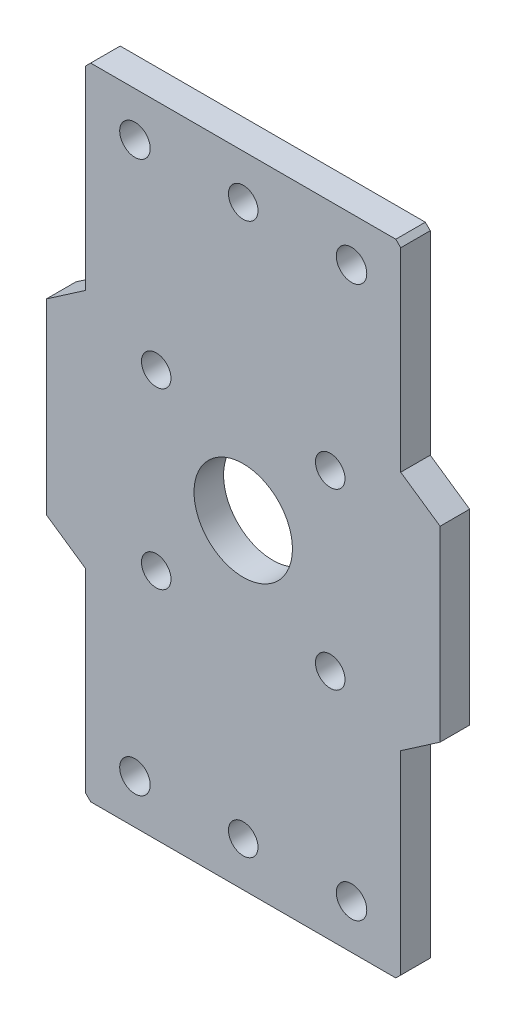
from build123d import *

# Parameters (mm, degrees)
IZIM1_R                      = 1
Y_KSEKLIK_EKSTR_ZYON1_DEPTH  = 3
KES_EKSTR_ZYON1_DEPTH        = 10
Y_KSEKLIK_EKSTR_ZYON2_DEPTH  = 3
IZIM6_R                      = 1.55
Y_KSEKLIK_EKSTR_ZYON4_DEPTH  = 3
IZIM9_W                      = 2.764853826
IZIM9_H                      = 2.899724745
IZIM9_W_2                    = 2.53555673
IZIM9_H_2                    = 2.630505748
Y_KSEKLIK_EKSTR_ZYON5_DEPTH  = 3
IZIM8_R                      = 1.55
Y_KSEKLIK_EKSTR_ZYON6_DEPTH  = 3
IZIM10_R                     = 1.55
KES_EKSTR_ZYON2_DEPTH        = 10
IZIM14_R                     = 1.5
KES_EKSTR_ZYON3_DEPTH        = 10
IZIM15_R                     = 5
KES_EKSTR_ZYON4_DEPTH        = 10
Y_KSEKLIK_EKSTR_ZYON7_DEPTH  = 3
KES_EKSTR_ZYON5_DEPTH        = 3
IZIM23_R                     = 1.55
KES_EKSTR_ZYON6_DEPTH        = 3
IZIM25_R                     = 1.5
KES_EKSTR_ZYON7_DEPTH        = 3
Y_KSEKLIK_EKSTR_ZYON8_DEPTH  = 3
IZIM27_W                     = 26
IZIM27_H                     = 10
Y_KSEKLIK_EKSTR_ZYON9_DEPTH  = 3
IZIM28_W                     = 32
IZIM28_H                     = 10.183470431
KES_EKSTR_ZYON8_DEPTH        = 10
IZIM29_W                     = 21.597894427
IZIM29_H                     = 9.610197834
Y_KSEKLIK_EKSTR_ZYON11_DEPTH = 3
IZIM30_W                     = 32
IZIM30_H                     = 0.75
IZIM30_H_2                   = 0.5
KES_EKSTR_ZYON9_DEPTH        = 10
PAH1_SIZE                    = 0.5


with BuildPart() as part:
    # Çizim1 → Yükseklik-Ekstrüzyon1 (new body)
    # profile 1 of 2: a face of its own
    with BuildSketch(Plane.XY):
        Polygon((7.5, 49.5), (0, 49.5), (0, 46.25495549), (3, 46.25495549), (3.494974747, 46.749930237), (5.494974747, 46.749930237), (8.5, 44.749930237), (8.5, 43.249930237), (8.5, 41.749930237), (5.494974747, 39.749930237), (3.494974747, 39.749930237), (3, 40.244904984), (0, 40.244904984), (0, -51.5), (8.5, -51.5), (13.25, -48.202566926), (13.25, -43.75), (12.5, -43), (12.5, -35), (13.25, -34.25), (13.25, -28.25), (12.5, -27.5), (12.5, -19.5), (13.25, -18.75), (13.25, -12.75), (12.5, -12), (12.5, -4), (14, -2.5), (14, -2), (16, 0), (16, 13), (20, 15.75), (20, 33.5), (20, 34.75), (16, 37.5), (16, 47.5), (12, 51.5), (9.5, 51.5), align=None)
        Polygon((2.624434095, -42.600069763), (3.119408841, -42.105095016), (3.119408841, -36.105095016), (2.624434095, -35.610120269), (2.624434095, -33.610120269), (4.624434095, -30.605095016), (6.124434095, -30.605095016), (7.624434095, -30.605095016), (9.624434095, -33.610120269), (9.624434095, -35.610120269), (9.129459348, -36.105095016), (9.129459348, -42.105095016), (9.624434095, -42.600069763), (9.624434095, -44.600069763), (7.624434095, -47.605095016), (6.124434095, -47.605095016), (4.624434095, -47.605095016), (2.624434095, -44.600069763), align=None, mode=Mode.SUBTRACT)
        Polygon((4.624434095, -7.305095016), (6.124434095, -7.305095016), (7.624434095, -7.305095016), (9.624434095, -10.310120269), (9.624434095, -12.310120269), (9.129459348, -12.805095016), (9.129459348, -18.805095016), (9.624434095, -19.300069763), (9.624434095, -21.300069763), (7.624434095, -24.305095016), (6.124434095, -24.305095016), (4.624434095, -24.305095016), (2.624434095, -21.300069763), (2.624434095, -19.300069763), (3.119408841, -18.805095016), (3.119408841, -12.805095016), (2.624434095, -12.310120269), (2.624434095, -10.310120269), align=None, mode=Mode.SUBTRACT)
        with Locations((11, -0.75)):
            Circle(IZIM1_R, mode=Mode.SUBTRACT)
        with Locations((11, 48.25)):
            Circle(IZIM1_R, mode=Mode.SUBTRACT)
    # profile 2 of 2: a face of its own
    with BuildSketch(Plane.XY):
        Polygon((-9.5, 51.5), (-12, 51.5), (-16, 47.5), (-16, 37.5), (-20, 34.75), (-20, 33.5), (-20, 15.75), (-16, 13), (-16, 0), (-14, -2), (-14, -2.5), (-12.5, -4), (-12.5, -12), (-13.25, -12.75), (-13.25, -18.75), (-12.5, -19.5), (-12.5, -27.5), (-13.25, -28.25), (-13.25, -34.25), (-12.5, -35), (-12.5, -43), (-13.25, -43.75), (-13.25, -48.202566926), (-8.5, -51.5), (0, -51.5), (0, 40.244904984), (-3, 40.244904984), (-3.494974747, 39.749930237), (-5.494974747, 39.749930237), (-8.5, 41.749930237), (-8.5, 43.249930237), (-8.5, 44.749930237), (-5.494974747, 46.749930237), (-3.494974747, 46.749930237), (-3, 46.25495549), (0, 46.25495549), (0, 49.5), (-7.5, 49.5), align=None)
        Polygon((-2.624434095, -35.610120269), (-3.119408841, -36.105095016), (-3.119408841, -42.105095016), (-2.624434095, -42.600069763), (-2.624434095, -44.600069763), (-4.624434095, -47.605095016), (-6.124434095, -47.605095016), (-7.624434095, -47.605095016), (-9.624434095, -44.600069763), (-9.624434095, -42.600069763), (-9.129459348, -42.105095016), (-9.129459348, -36.105095016), (-9.624434095, -35.610120269), (-9.624434095, -33.610120269), (-7.624434095, -30.605095016), (-6.124434095, -30.605095016), (-4.624434095, -30.605095016), (-2.624434095, -33.610120269), align=None, mode=Mode.SUBTRACT)
        with Locations((-11, -0.75)):
            Circle(IZIM1_R, mode=Mode.SUBTRACT)
        Polygon((-3.119408841, -18.805095016), (-2.624434095, -19.300069763), (-2.624434095, -21.300069763), (-4.624434095, -24.305095016), (-6.124434095, -24.305095016), (-7.624434095, -24.305095016), (-9.624434095, -21.300069763), (-9.624434095, -19.300069763), (-9.129459348, -18.805095016), (-9.129459348, -12.805095016), (-9.624434095, -12.310120269), (-9.624434095, -10.310120269), (-7.624434095, -7.305095016), (-6.124434095, -7.305095016), (-4.624434095, -7.305095016), (-2.624434095, -10.310120269), (-2.624434095, -12.310120269), (-3.119408841, -12.805095016), align=None, mode=Mode.SUBTRACT)
        with Locations((-11, 48.25)):
            Circle(IZIM1_R, mode=Mode.SUBTRACT)
    extrude(amount=Y_KSEKLIK_EKSTR_ZYON1_DEPTH)

    # Çizim2 → Kes-Ekstrüzyon1 (cut)
    with BuildSketch(Plane.XY.offset(3)):
        Polygon((-12.5, -4), (12.5, -4), (38.548396408, -28.529419771), (17.359301926, -71.305004234), (-44.147930668, -53.058839542), align=None)
    extrude(amount=-KES_EKSTR_ZYON1_DEPTH, mode=Mode.SUBTRACT)

    # Çizim3 → Yükseklik-Ekstrüzyon2 (add)
    with BuildSketch(Plane.XY.offset(3)):
        Polygon((9.5, 51.5), (-9.5, 51.5), (-7.5, 49.5), (7.5, 49.5), align=None)
    extrude(amount=-Y_KSEKLIK_EKSTR_ZYON2_DEPTH)

    # Çizim6 → Yükseklik-Ekstrüzyon4 (add)
    with BuildSketch(Plane.XY.offset(3)):
        Polygon((-16, 47.5), (-16, 54.5), (-12, 58.5), (12, 58.5), (16, 54.5), (16, 47.5), (12.510789388, 45.937791763), (6.230146787, 48.369008254), (-4.136290194, 49.078113063), (-9.944196255, 45.397521432), align=None)
        with Locations((11, 53.25)):
            Circle(IZIM6_R, mode=Mode.SUBTRACT)
        with Locations((-11, 53.25)):
            Circle(IZIM6_R, mode=Mode.SUBTRACT)
    extrude(amount=-Y_KSEKLIK_EKSTR_ZYON4_DEPTH)

    # Çizim9 → Yükseklik-Ekstrüzyon5 (add)
    with BuildSketch(Plane.XY.offset(3)):
        with Locations((-10.828696241, -0.299998429)):
            Rectangle(IZIM9_W, IZIM9_H)
        with Locations((11.040614903, -0.603719415)):
            Rectangle(IZIM9_W_2, IZIM9_H_2)
    extrude(amount=-Y_KSEKLIK_EKSTR_ZYON5_DEPTH)

    # Çizim8 → Yükseklik-Ekstrüzyon6 (add)
    with BuildSketch(Plane.XY.offset(3)):
        Polygon((-16, 0), (-16, -2), (-12.5, -6), (12.5, -6), (16, -2), (16, 0), (12.001079667, 1.705733335), (6.853090616, -1.163543143), (-3.589444332, -1.163543143), (-11.459943544, 2.530439958), align=None)
        with Locations((-11, -2.75)):
            Circle(IZIM8_R, mode=Mode.SUBTRACT)
        with Locations((11, -2.75)):
            Circle(IZIM8_R, mode=Mode.SUBTRACT)
    extrude(amount=-Y_KSEKLIK_EKSTR_ZYON6_DEPTH)

    # Çizim10 → Kes-Ekstrüzyon2 (cut)
    with BuildSketch(Plane.XY.offset(3)):
        with Locations((-11, -2.75)):
            Circle(IZIM10_R)
        with Locations((11, -2.75)):
            Circle(IZIM10_R)
    extrude(amount=-KES_EKSTR_ZYON2_DEPTH, mode=Mode.SUBTRACT)

    # Çizim14 → Kes-Ekstrüzyon3 (cut)
    with BuildSketch(Plane.XY.offset(3)):
        with Locations((8.838834765, 34.088834765)):
            Circle(IZIM14_R)
        with Locations((-8.838834765, 16.411165235)):
            Circle(IZIM14_R)
        with Locations((8.838834765, 16.411165235)):
            Circle(IZIM14_R)
        with Locations((-8.838834765, 34.088834765)):
            Circle(IZIM14_R)
    extrude(amount=-KES_EKSTR_ZYON3_DEPTH, mode=Mode.SUBTRACT)

    # Çizim15 → Kes-Ekstrüzyon4 (cut)
    with BuildSketch(Plane.XY.offset(3)):
        with Locations((0, 25.25)):
            Circle(IZIM15_R)
    extrude(amount=-KES_EKSTR_ZYON4_DEPTH, mode=Mode.SUBTRACT)

    # Çizim19 → Yükseklik-Ekstrüzyon7 (add)
    with BuildSketch(Plane.XY.offset(3)):
        Polygon((-16, -13), (-12, -17), (12, -17), (16, -13), (16, -2), (-16, -2), align=None)
    extrude(amount=-Y_KSEKLIK_EKSTR_ZYON7_DEPTH)

    # Çizim22 → Kes-Ekstrüzyon5 (cut)
    with BuildSketch(Plane.XY.offset(3)):
        Polygon((3, -7.610667932), (3.494974747, -7.115693185), (5.494974747, -7.115693185), (8.5, -9.115693185), (8.5, -12.115693185), (5.494974747, -14.115693185), (3.494974747, -14.115693185), (3, -13.620718438), (-3, -13.620718438), (-3.494974747, -14.115693185), (-5.494974747, -14.115693185), (-8.5, -12.115693185), (-8.5, -9.115693185), (-5.494974747, -7.115693185), (-3.494974747, -7.115693185), (-3, -7.610667932), align=None)
    extrude(amount=-KES_EKSTR_ZYON5_DEPTH, mode=Mode.SUBTRACT)

    # Çizim23 → Kes-Ekstrüzyon6 (cut)
    with BuildSketch(Plane.XY.offset(3)):
        with Locations((-11, -2.75)):
            Circle(IZIM23_R)
        with Locations((11, -2.75)):
            Circle(IZIM23_R)
    extrude(amount=-KES_EKSTR_ZYON6_DEPTH, mode=Mode.SUBTRACT)

    # Çizim25 → Kes-Ekstrüzyon7 (cut)
    with BuildSketch(Plane.XY.offset(3)):
        with Locations((0, -2.75)):
            Circle(IZIM25_R)
        with Locations((0, 53.25)):
            Circle(IZIM25_R)
    extrude(amount=-KES_EKSTR_ZYON7_DEPTH, mode=Mode.SUBTRACT)

    # Çizim26 → Yükseklik-Ekstrüzyon8 (add)
    with BuildSketch(Plane.XY.offset(3)):
        Polygon((-16, 54.5), (-12, 58.5), (-16, 58.5), align=None)
        Polygon((12, 58.5), (16, 54.5), (16, 58.5), align=None)
    extrude(amount=-Y_KSEKLIK_EKSTR_ZYON8_DEPTH)

    # Çizim27 → Yükseklik-Ekstrüzyon9 (add)
    with BuildSketch(Plane.XY.offset(3)):
        with Locations((-1, -12)):
            Rectangle(IZIM27_W, IZIM27_H)
    extrude(amount=-Y_KSEKLIK_EKSTR_ZYON9_DEPTH)

    # Çizim28 → Kes-Ekstrüzyon8 (cut)
    with BuildSketch(Plane.XY.offset(3)):
        with Locations((0, -12.841735215)):
            Rectangle(IZIM28_W, IZIM28_H)
    extrude(amount=-KES_EKSTR_ZYON8_DEPTH, mode=Mode.SUBTRACT)

    # Çizim29 → Yükseklik-Ekstrüzyon11 (add)
    with BuildSketch(Plane.XY.offset(3)):
        with Locations((0.687303888, 43.184879182)):
            Rectangle(IZIM29_W, IZIM29_H)
    extrude(amount=-Y_KSEKLIK_EKSTR_ZYON11_DEPTH)

    # Çizim30 → Kes-Ekstrüzyon9 (cut)
    with BuildSketch(Plane.XY.offset(3)):
        with Locations((0, 58.125)):
            Rectangle(IZIM30_W, IZIM30_H)
        with Locations((0, -7.5)):
            Rectangle(IZIM30_W, IZIM30_H_2)
    extrude(amount=-KES_EKSTR_ZYON9_DEPTH, mode=Mode.SUBTRACT)

    # Pah1
    pah1_edges = [part.edges().sort_by_distance(p)[0] for p in [
        (16, 57.75, 1.5),
        (-16, 57.75, 1.5),
        (-16, -7.25, 1.5),
        (16, -7.25, 1.5),
    ]]
    chamfer(pah1_edges, length=PAH1_SIZE)


solid = part.part
